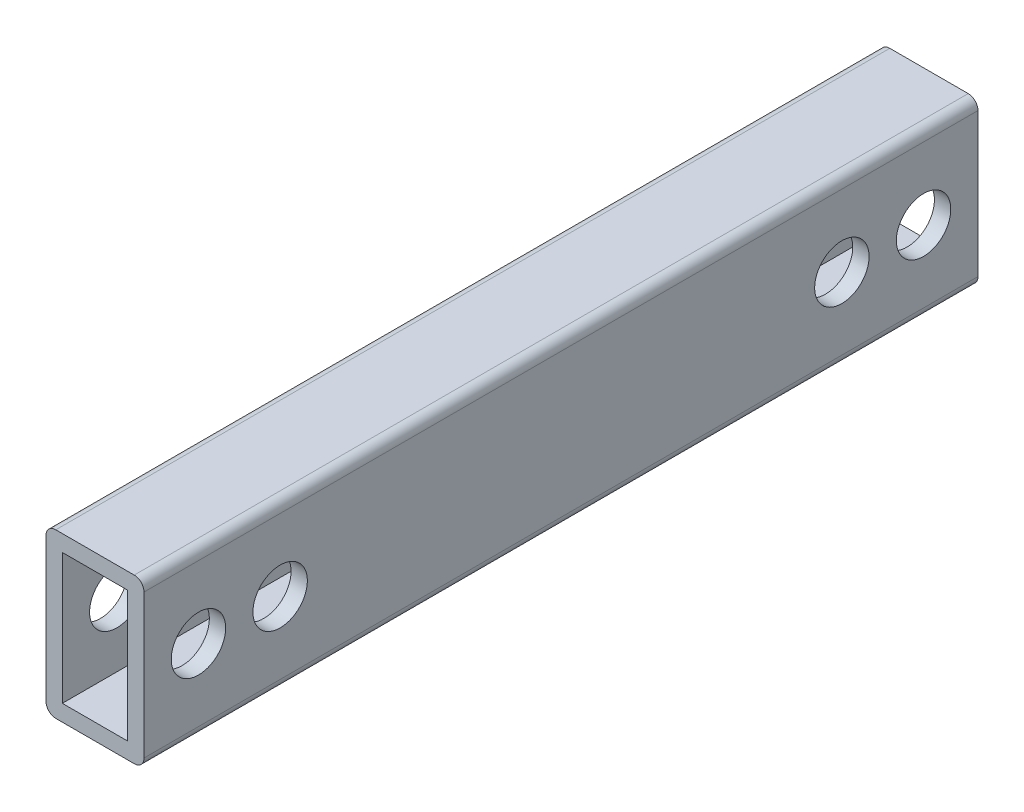
from build123d import *

# Parameters (mm, degrees)
SKETCH1_W         = 18
SKETCH1_H         = 30
SKETCH1_W_2       = 12
SKETCH1_H_2       = 24
BODY_DEPTH        = 153.15701543
SKETCH2_R         = 5
MOUNT_HOLES_DEPTH = 155.938927889
CORNER_FILLETS_R  = 1.8


with BuildPart() as part:
    # Sketch1 → Body (new body)
    with BuildSketch(Plane.XY):
        Rectangle(SKETCH1_W, SKETCH1_H)
        Rectangle(SKETCH1_W_2, SKETCH1_H_2, mode=Mode.SUBTRACT)
    extrude(amount=BODY_DEPTH)

    # Sketch2 → Mount Holes (cut, through all)
    with BuildSketch(Plane(origin=(9, 0, 0), x_dir=(0, 0, -1), z_dir=(1, 0, 0))):
        with Locations((-143.15701543, 0)):
            Circle(SKETCH2_R)
        with Locations((-128.15701543, 0)):
            Circle(SKETCH2_R)
        with Locations(Location((-25, 0, 0), (0, 0, 180))):
            Circle(SKETCH2_R)
        with Locations(Location((-10, 0, 0), (0, 0, 180))):
            Circle(SKETCH2_R)
    extrude(amount=-MOUNT_HOLES_DEPTH, mode=Mode.SUBTRACT)

    # Corner Fillets
    corner_fillets_edges = [part.edges().sort_by_distance(p)[0] for p in [
        (-9, 15, 76.578507715),
        (9, 15, 76.578507715),
        (9, -15, 76.578507715),
        (-9, -15, 76.578507715),
    ]]
    fillet(corner_fillets_edges, radius=CORNER_FILLETS_R)


solid = part.part
